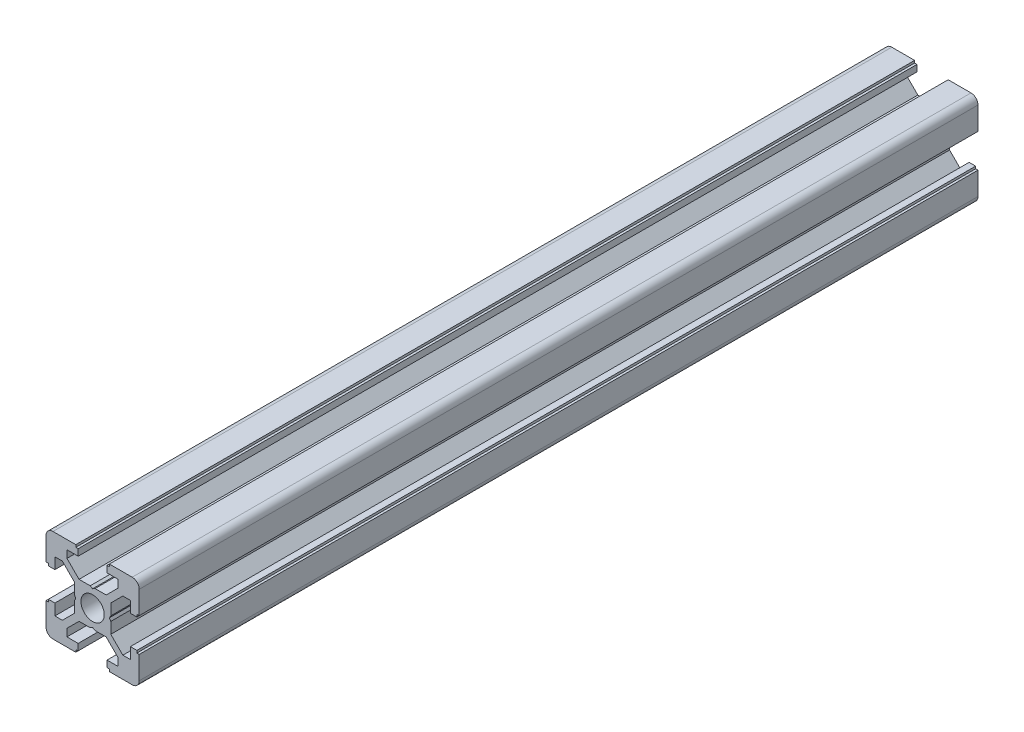
from build123d import *

# Parameters (mm, degrees)
SKETCH_28_R     = 2.5
EXTRUDE_1_DEPTH = 180


with BuildPart() as part:
    # 草图28 → 凸台-拉伸1 (new body)
    with BuildSketch(Plane.XY):
        with BuildLine():
            Line((-3.9, -0.519615242), (-3.9, -2.910050506))
            Line((-3.9, -2.910050506), (-6.489949494, -5.5))
            Line((-6.489949494, -5.5), (-8.1, -5.5))
            Line((-8.1, -5.5), (-8.1, -3.1))
            Line((-8.1, -3.1), (-9.5, -3.1))
            Line((-9.5, -3.1), (-9.5, -3.6))
            Line((-9.5, -3.6), (-10, -3.6))
            Line((-10, -3.6), (-10, -8.5))
            ThreePointArc((-10, -8.5), (-9.560660172, -9.560660172), (-8.5, -10))
            Line((-8.5, -10), (-3.6, -10))
            Line((-3.6, -10), (-3.6, -9.5))
            Line((-3.6, -9.5), (-3.1, -9.5))
            Line((-3.1, -9.5), (-3.1, -8.1))
            Line((-3.1, -8.1), (-5.5, -8.1))
            Line((-5.5, -8.1), (-5.5, -6.489949494))
            Line((-5.5, -6.489949494), (-2.910050506, -3.9))
            Line((-2.910050506, -3.9), (-0.519615242, -3.9))
            Line((-0.519615242, -3.9), (0, -3.6))
            Line((0, -3.6), (0.519615242, -3.9))
            Line((0.519615242, -3.9), (2.910050506, -3.9))
            Line((2.910050506, -3.9), (5.5, -6.489949494))
            Line((5.5, -6.489949494), (5.5, -8.1))
            Line((5.5, -8.1), (3.1, -8.1))
            Line((3.1, -8.1), (3.1, -9.5))
            Line((3.1, -9.5), (3.6, -9.5))
            Line((3.6, -9.5), (3.6, -10))
            Line((3.6, -10), (8.5, -10))
            ThreePointArc((8.5, -10), (9.560660172, -9.560660172), (10, -8.5))
            Line((10, -8.5), (10, -3.6))
            Line((10, -3.6), (9.5, -3.6))
            Line((9.5, -3.6), (9.5, -3.1))
            Line((9.5, -3.1), (8.1, -3.1))
            Line((8.1, -3.1), (8.1, -5.5))
            Line((8.1, -5.5), (6.489949494, -5.5))
            Line((6.489949494, -5.5), (3.9, -2.910050506))
            Line((3.9, -2.910050506), (3.9, -0.519615242))
            Line((3.9, -0.519615242), (3.6, 0))
            Line((3.6, 0), (3.9, 0.519615242))
            Line((3.9, 0.519615242), (3.9, 2.910050506))
            Line((3.9, 2.910050506), (6.489949494, 5.5))
            Line((6.489949494, 5.5), (8.1, 5.5))
            Line((8.1, 5.5), (8.1, 3.1))
            Line((8.1, 3.1), (9.5, 3.1))
            Line((9.5, 3.1), (9.5, 3.6))
            Line((9.5, 3.6), (10, 3.6))
            Line((10, 3.6), (10, 8.5))
            ThreePointArc((10, 8.5), (9.560660172, 9.560660172), (8.5, 10))
            Line((8.5, 10), (3.6, 10))
            Line((3.6, 10), (3.6, 9.5))
            Line((3.6, 9.5), (3.1, 9.5))
            Line((3.1, 9.5), (3.1, 8.1))
            Line((3.1, 8.1), (5.5, 8.1))
            Line((5.5, 8.1), (5.5, 6.489949494))
            Line((5.5, 6.489949494), (2.910050506, 3.9))
            Line((2.910050506, 3.9), (0.519615242, 3.9))
            Line((0.519615242, 3.9), (0, 3.6))
            Line((0, 3.6), (-0.519615242, 3.9))
            Line((-0.519615242, 3.9), (-2.910050506, 3.9))
            Line((-2.910050506, 3.9), (-5.5, 6.489949494))
            Line((-5.5, 6.489949494), (-5.5, 8.1))
            Line((-5.5, 8.1), (-3.1, 8.1))
            Line((-3.1, 8.1), (-3.1, 9.5))
            Line((-3.1, 9.5), (-3.6, 9.5))
            Line((-3.6, 9.5), (-3.6, 10))
            Line((-3.6, 10), (-8.5, 10))
            ThreePointArc((-8.5, 10), (-9.560660172, 9.560660172), (-10, 8.5))
            Line((-10, 8.5), (-10, 3.6))
            Line((-10, 3.6), (-9.5, 3.6))
            Line((-9.5, 3.6), (-9.5, 3.1))
            Line((-9.5, 3.1), (-8.1, 3.1))
            Line((-8.1, 3.1), (-8.1, 5.5))
            Line((-8.1, 5.5), (-6.489949494, 5.5))
            Line((-6.489949494, 5.5), (-3.9, 2.910050506))
            Line((-3.9, 2.910050506), (-3.9, 0.519615242))
            Line((-3.9, 0.519615242), (-3.6, 0))
            Line((-3.6, 0), (-3.9, -0.519615242))
        make_face()
        with Locations(Location((0, 0, 0), (0, 0, 180))):
            Circle(SKETCH_28_R, mode=Mode.SUBTRACT)
    extrude(amount=EXTRUDE_1_DEPTH)


solid = part.part
